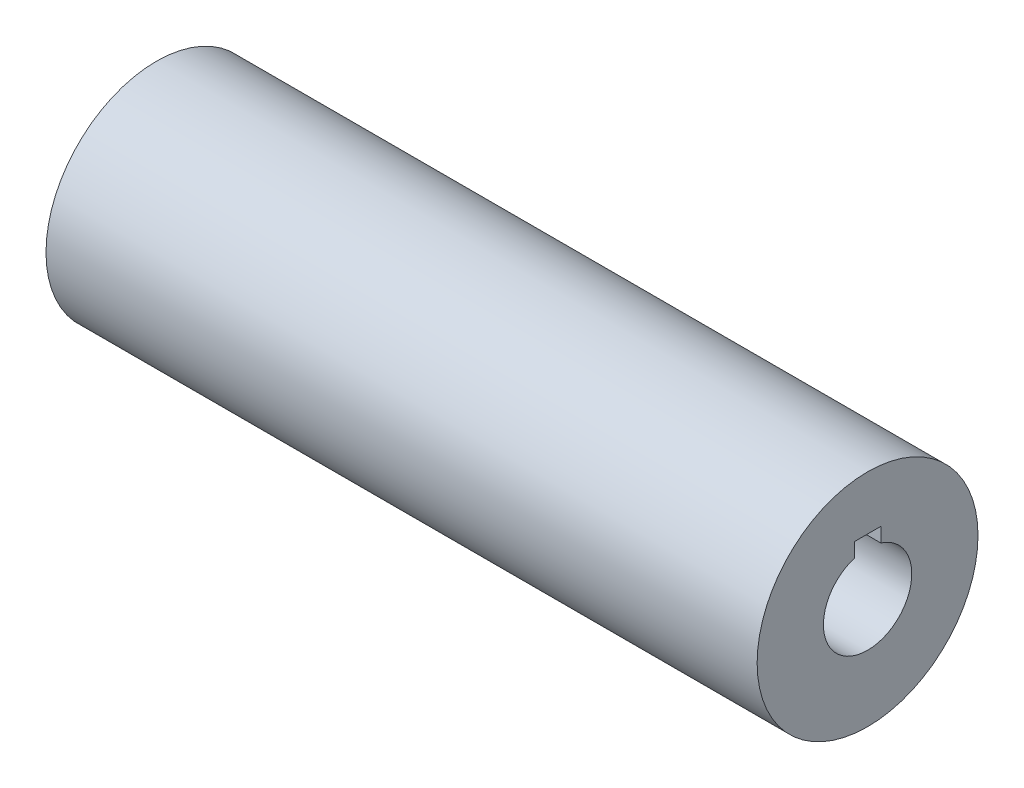
from build123d import *

# Parameters (mm, degrees)
IZIM1_R                     = 25
IZIM1_R_2                   = 10
Y_KSEKLIK_EKSTR_ZYON1_DEPTH = 80.5
IZIM3_W                     = 6
IZIM3_H                     = 5.6
KES_EKSTR_ZYON1_DEPTH       = 80.5


with BuildPart() as part:
    # Çizim1 → Yükseklik-Ekstrüzyon1 (new, symmetric)
    with BuildSketch(Plane(origin=(0, 0, 0), x_dir=(0, 0, -1), z_dir=(1, 0, 0))):
        Circle(IZIM1_R)
        Circle(IZIM1_R_2, mode=Mode.SUBTRACT)
    extrude(amount=Y_KSEKLIK_EKSTR_ZYON1_DEPTH, both=True)

    # Çizim3 → Kes-Ekstrüzyon1 (cut, symmetric)
    with BuildSketch(Plane(origin=(0, 0, 0), x_dir=(0, 0, -1), z_dir=(1, 0, 0))):
        with Locations((0, 10)):
            Rectangle(IZIM3_W, IZIM3_H)
    extrude(amount=KES_EKSTR_ZYON1_DEPTH, both=True, mode=Mode.SUBTRACT)


solid = part.part
